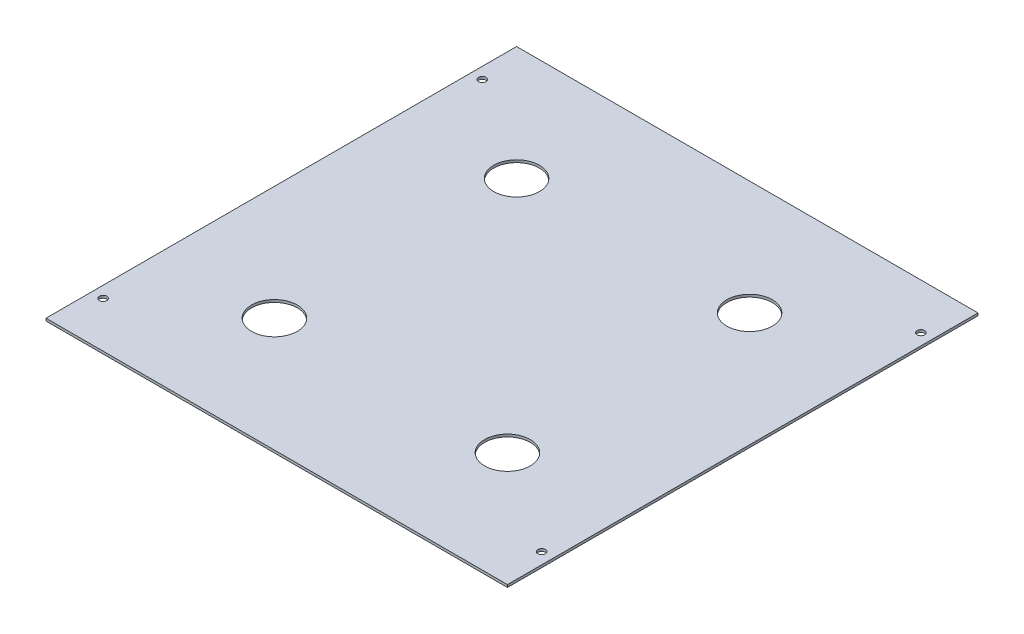
from build123d import *

# Parameters (mm, degrees)
SKETCH1_W           = 202
SKETCH1_H           = 206
SKETCH1_R           = 1.65
SKETCH1_R_2         = 10
BOSS_EXTRUDE1_DEPTH = 1.1


with BuildPart() as part:
    # Sketch1 → Boss-Extrude1 (new body)
    with BuildSketch(Plane(origin=(0, 0, 0), x_dir=(1, 0, 0), z_dir=(0, 1, 0))):
        with Locations((101, 103)):
            Rectangle(SKETCH1_W, SKETCH1_H)
        with Locations(Location((5, 186, 0), (0, 0, 270))):
            Circle(SKETCH1_R, mode=Mode.SUBTRACT)
        with Locations(Location((50, 156, 0), (0, 0, 270))):
            Circle(SKETCH1_R_2, mode=Mode.SUBTRACT)
        with Locations(Location((152, 156, 0), (0, 0, 270))):
            Circle(SKETCH1_R_2, mode=Mode.SUBTRACT)
        with Locations(Location((50, 50, 0), (0, 0, 270))):
            Circle(SKETCH1_R_2, mode=Mode.SUBTRACT)
        with Locations(Location((152, 50, 0), (0, 0, 270))):
            Circle(SKETCH1_R_2, mode=Mode.SUBTRACT)
        with Locations(Location((5, 20, 0), (0, 0, 270))):
            Circle(SKETCH1_R, mode=Mode.SUBTRACT)
        with Locations(Location((197, 20, 0), (0, 0, 270))):
            Circle(SKETCH1_R, mode=Mode.SUBTRACT)
        with Locations(Location((197, 186, 0), (0, 0, 270))):
            Circle(SKETCH1_R, mode=Mode.SUBTRACT)
    extrude(amount=BOSS_EXTRUDE1_DEPTH)


solid = part.part
